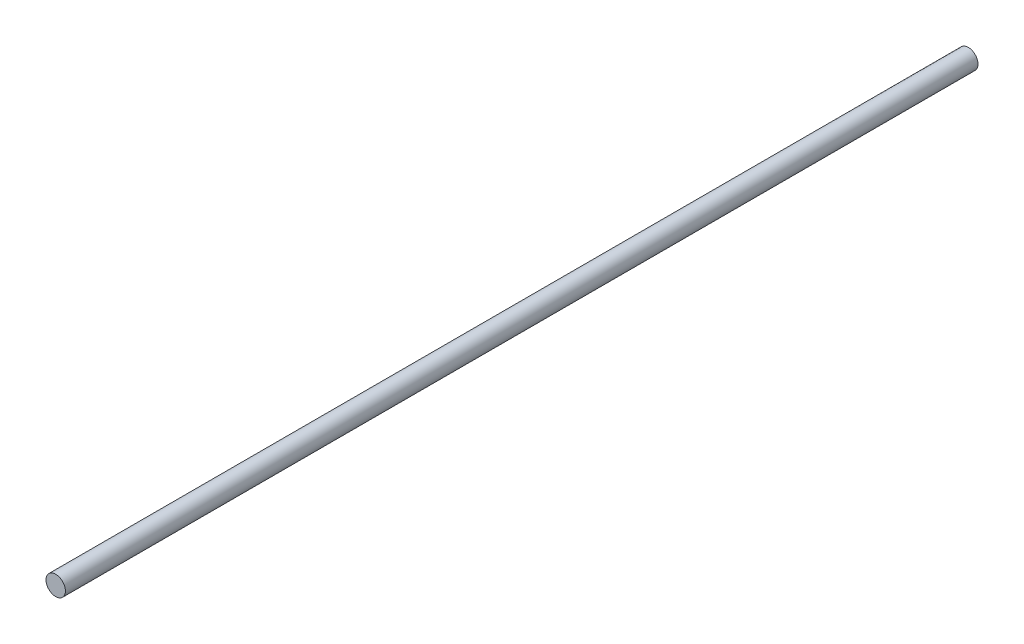
from build123d import *

# Parameters (mm, degrees)
SCHIZZO1_R                   = 4
ESTRUSIONE_ESTRUSIONE2_DEPTH = 375.7


with BuildPart() as part:
    # Schizzo1 → Estrusione-Estrusione2 (new body)
    with BuildSketch(Plane.XY):
        Circle(SCHIZZO1_R)
    extrude(amount=-ESTRUSIONE_ESTRUSIONE2_DEPTH)


solid = part.part
